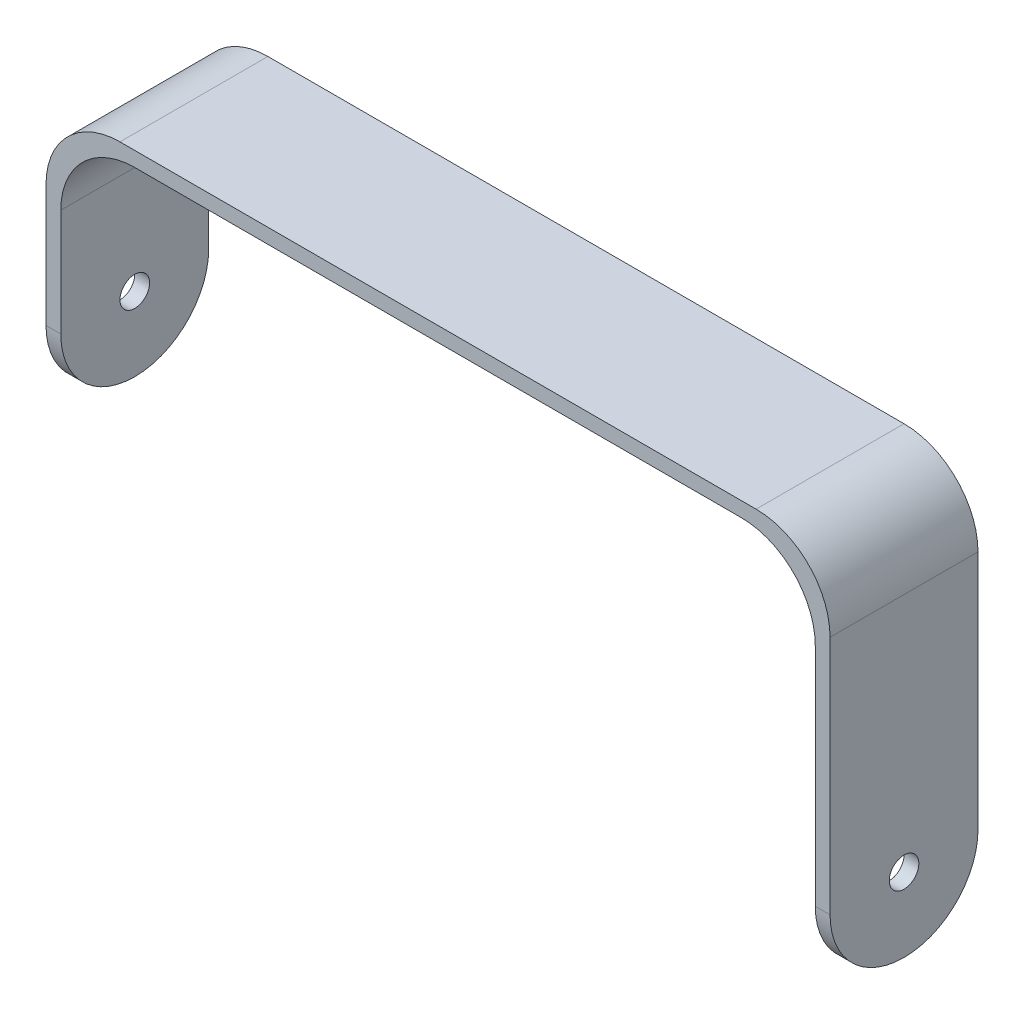
from build123d import *

# Parameters (mm, degrees)
SUPERFICIE_EXTRUIR1_1_BACK  = 10
SUPERFICIE_EXTRUIR1_1_DEPTH = 20
DAR_ESPESOR1_T1             = 2
CROQUIS2_R                  = 2
CORTAR_EXTRUIR1_DEPTH       = 2
REDONDEO1_R                 = 10
CROQUIS3_R                  = 2
CORTAR_EXTRUIR2_DEPTH       = 2


with BuildPart() as body_1:
    # Superficie-Extruir1: a surface, the sketch's curves swept straight by 20 mm
    with BuildLine(Plane.XY.offset(-SUPERFICIE_EXTRUIR1_1_BACK), mode=Mode.PRIVATE) as superficie_extruir1_1_path:
        Line((-51, 0), (-51, 35))
        Line((-51, 35), (51, 35))
        Line((51, 35), (51, 0))
        Line((51, 0), (51, -16))
    superficie_extruir1_1 = Shell.extrude(superficie_extruir1_1_path.wire(), (0 * SUPERFICIE_EXTRUIR1_1_DEPTH, 0 * SUPERFICIE_EXTRUIR1_1_DEPTH, 1 * SUPERFICIE_EXTRUIR1_1_DEPTH))
    add(Solid.thicken(superficie_extruir1_1, DAR_ESPESOR1_T1))

    # Croquis2 → Cortar-Extruir1 (cut)
    with BuildSketch(Plane.ZY.offset(53)):
        with Locations((0, 10.5)):
            Circle(CROQUIS2_R)
        with BuildLine():
            Line((-10, 10.5), (-10, 0))
            Line((-10, 0), (10, 0))
            Line((10, 0), (10, 10.5))
            ThreePointArc((10, 10.5), (0, 0.5), (-10, 10.5))
        make_face()
    extrude(amount=-CORTAR_EXTRUIR1_DEPTH, mode=Mode.SUBTRACT)

    # Redondeo1
    redondeo1_edges = [body_1.edges().sort_by_distance(p)[0] for p in [
        (-51, 35, 0),
        (51, 35, 0),
        (53, 37, 0),
        (-53, 37, 0),
    ]]
    fillet(redondeo1_edges, radius=REDONDEO1_R)

    # Croquis3 → Cortar-Extruir2 (cut)
    with BuildSketch(Plane(origin=(53, 0, 0), x_dir=(0, 0, -1), z_dir=(1, 0, 0))):
        with Locations((0, -5.5)):
            Circle(CROQUIS3_R)
        with BuildLine():
            Line((-10, -5.5), (-10, -16))
            Line((-10, -16), (10, -16))
            Line((10, -16), (10, -5.5))
            ThreePointArc((10, -5.5), (0, -15.5), (-10, -5.5))
        make_face()
    extrude(amount=-CORTAR_EXTRUIR2_DEPTH, mode=Mode.SUBTRACT)


solid = body_1.part
